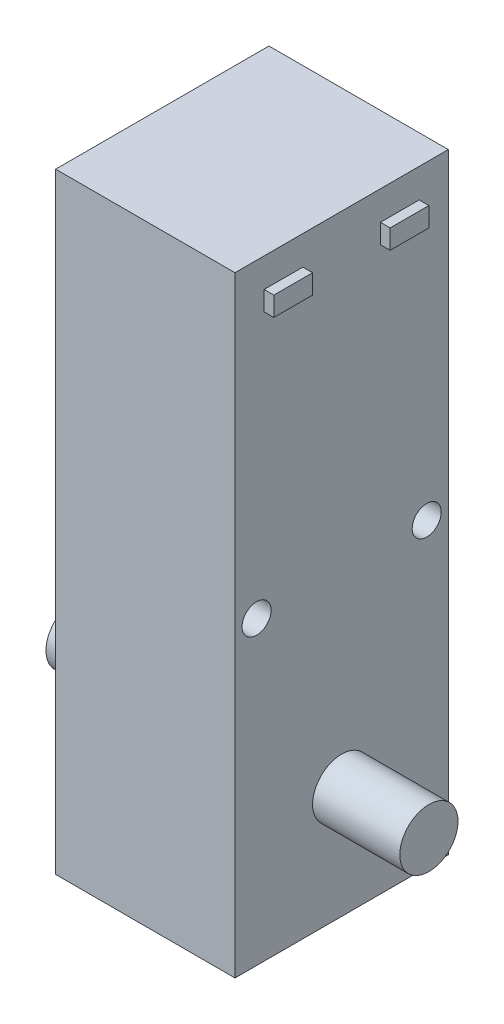
from build123d import *

# Parameters (mm, degrees)
ESQUISSE1_W             = 22
ESQUISSE1_H             = 63
ESQUISSE1_R             = 1.5
BOSS_EXTRU_1_DEPTH      = 18.5
BOSS_EXTRU_2_DEPTH      = 9
BOSS_EXTRU_2_DEPTH_BACK = 27.5
ESQUISSE2_R             = 3
ESQUISSE3_W             = 4
ESQUISSE3_H             = 2
BOSS_EXTRU_3_DEPTH      = 1


with BuildPart() as part:
    # Esquisse1 → Boss.-Extru.1 (new body)
    with BuildSketch(Plane(origin=(0, 0, 0), x_dir=(0, 0, -1), z_dir=(1, 0, 0))):
        with Locations((11, 31.5)):
            Rectangle(ESQUISSE1_W, ESQUISSE1_H)
        with Locations((2.225, 31)):
            Circle(ESQUISSE1_R, mode=Mode.SUBTRACT)
        with Locations(Location((19.775, 31, 0), (0, 0, 180))):
            Circle(ESQUISSE1_R, mode=Mode.SUBTRACT)
    extrude(amount=BOSS_EXTRU_1_DEPTH)

    # Esquisse2 → Boss.-Extru.2 (add, two sides: drawn at the far end of the back side and taken through both)
    with BuildSketch(Plane(origin=(18.5, 0, 0), x_dir=(0, 0, -1), z_dir=(1, 0, 0)).offset(-BOSS_EXTRU_2_DEPTH_BACK)):
        with Locations((11, 11.5)):
            Circle(ESQUISSE2_R)
    extrude(amount=BOSS_EXTRU_2_DEPTH + BOSS_EXTRU_2_DEPTH_BACK)

    # Esquisse3 → Boss.-Extru.3 (add)
    with BuildSketch(Plane(origin=(18.5, 0, 0), x_dir=(0, 0, -1), z_dir=(1, 0, 0))):
        with Locations((5, 59)):
            Rectangle(ESQUISSE3_W, ESQUISSE3_H)
        with Locations((17, 59)):
            Rectangle(ESQUISSE3_W, ESQUISSE3_H)
    extrude(amount=BOSS_EXTRU_3_DEPTH)


solid = part.part
